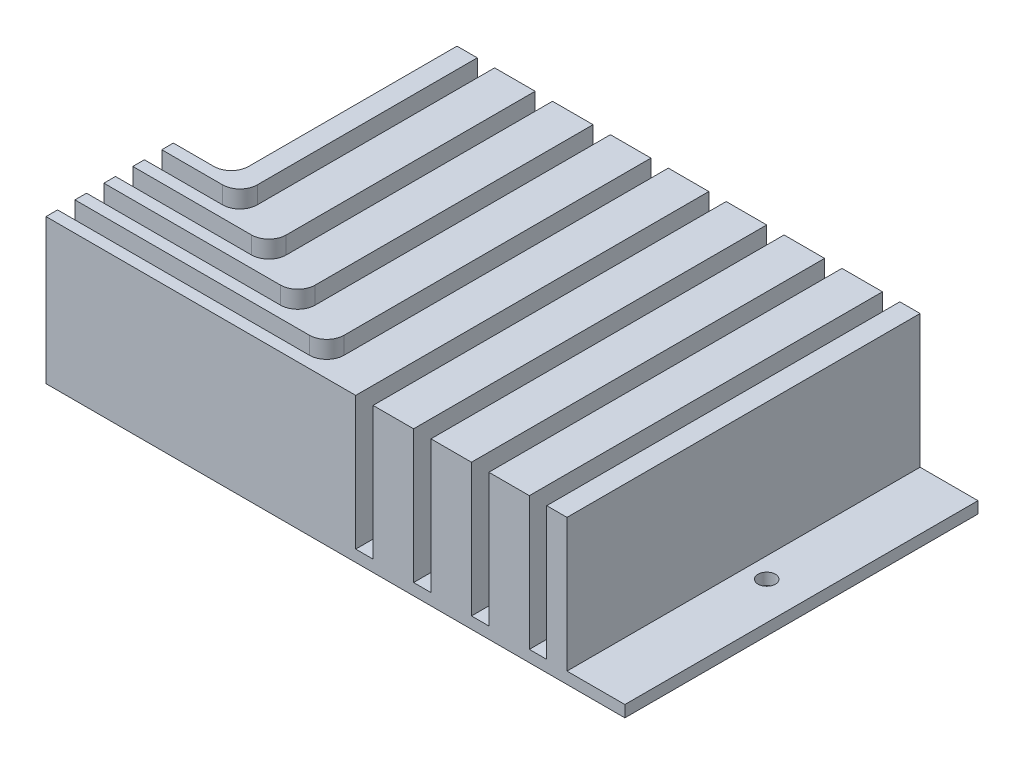
from build123d import *

# Parameters (mm, degrees)
PROFILESKETCH1_W                = 100
PROFILESKETCH1_H                = 61
PROFILEBOSS_EXTRUDE1_DEPTH      = 25
CABLE_GUIDESSKETCH2_W           = 3
CABLE_GUIDESSKETCH2_H           = 61
CABLEGUIDESCUT_EXTRUDE1_DEPTH   = 23
FASTENERTABSKETCH1_W            = 10
FASTENERTABSKETCH1_H            = 39
FASTENERTABSKETCH1_H_2          = 61
FASTENERTABCUT_EXTRUDE1_DEPTH   = 23
FASTENINGHOLESKETCH2_R          = 1.5
FASTENINGHOLECUT_EXTRUDE2_DEPTH = 120.774788666
FILLET1_R                       = 3
FILLET2_R                       = 3


with BuildPart() as part:
    # ProfileSketch1 → ProfileBoss-Extrude1 (new body)
    with BuildSketch(Plane(origin=(0, 0, 0), x_dir=(1, 0, 0), z_dir=(0, 1, 0))):
        with Locations((50, 30.5)):
            Rectangle(PROFILESKETCH1_W, PROFILESKETCH1_H)
    extrude(amount=PROFILEBOSS_EXTRUDE1_DEPTH)

    # Cable GuidesSketch2 → CableGuidesCut-Extrude1 (cut)
    with BuildSketch(Plane(origin=(0, 25, 0), x_dir=(1, 0, 0), z_dir=(0, 1, 0))):
        Polygon((43.5, 61), (46.5, 61), (46.5, 2), (0, 2), (0, 5), (43.5, 5), align=None)
        Polygon((0, 20), (0, 17), (16.5, 17), (16.5, 61), (13.5, 61), (13.5, 20), align=None)
        Polygon((0, 7), (36.5, 7), (36.5, 61), (33.5, 61), (33.5, 10), (0, 10), align=None)
        Polygon((0, 12), (26.5, 12), (26.5, 61), (23.5, 61), (23.5, 15), (0, 15), align=None)
        with Locations((55, 30.5)):
            Rectangle(CABLE_GUIDESSKETCH2_W, CABLE_GUIDESSKETCH2_H)
        with Locations((65, 30.5)):
            Rectangle(CABLE_GUIDESSKETCH2_W, CABLE_GUIDESSKETCH2_H)
        with Locations((75, 30.5)):
            Rectangle(CABLE_GUIDESSKETCH2_W, CABLE_GUIDESSKETCH2_H)
        with Locations((85, 30.5)):
            Rectangle(CABLE_GUIDESSKETCH2_W, CABLE_GUIDESSKETCH2_H)
    extrude(amount=-CABLEGUIDESCUT_EXTRUDE1_DEPTH, mode=Mode.SUBTRACT)

    # FastenerTabSketch1 → FastenerTabCut-Extrude1 (cut)
    with BuildSketch(Plane(origin=(0, 25, 0), x_dir=(1, 0, 0), z_dir=(0, 1, 0))):
        with Locations((5, 41.5)):
            Rectangle(FASTENERTABSKETCH1_W, FASTENERTABSKETCH1_H)
        with Locations((95, 30.5)):
            Rectangle(FASTENERTABSKETCH1_W, FASTENERTABSKETCH1_H_2)
    extrude(amount=-FASTENERTABCUT_EXTRUDE1_DEPTH, mode=Mode.SUBTRACT)

    # FasteningHoleSketch2 → FasteningHoleCut-Extrude2 (cut, through all)
    with BuildSketch(Plane(origin=(0, 25, 0), x_dir=(1, 0, 0), z_dir=(0, 1, 0))):
        with Locations(Location((6.5, 31, 0), (0, 0, 270))):
            Circle(FASTENINGHOLESKETCH2_R)
        with Locations(Location((93.5, 31, 0), (0, 0, 270))):
            Circle(FASTENINGHOLESKETCH2_R)
    extrude(amount=-FASTENINGHOLECUT_EXTRUDE2_DEPTH, mode=Mode.SUBTRACT)

    # Fillet1
    fillet1_edges = [part.edges().sort_by_distance(p)[0] for p in [
        (43.5, 13.5, -5),
        (23.5, 13.5, -15),
        (33.5, 13.5, -10),
        (13.5, 13.5, -20),
    ]]
    fillet(fillet1_edges, radius=FILLET1_R)

    # Fillet2
    fillet2_edges = [part.edges().sort_by_distance(p)[0] for p in [
        (46.5, 13.5, -2),
        (10, 13.5, -22),
        (26.5, 13.5, -12),
        (36.5, 13.5, -7),
        (16.5, 13.5, -17),
    ]]
    fillet(fillet2_edges, radius=FILLET2_R)


solid = part.part
